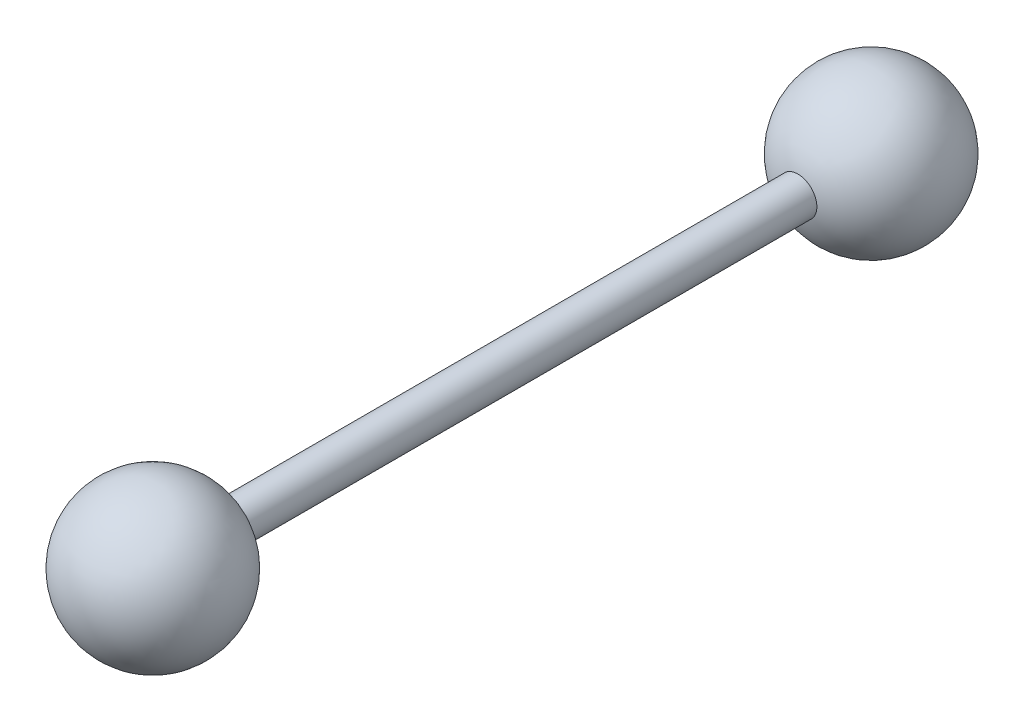
from build123d import *

# Parameters (mm, degrees)
SKETCH5_R                = 5
SKETCH5_R_2              = 3.5
BOSS_EXTRUDE2_DEPTH      = 4
BOSS_EXTRUDE3_DEPTH      = 154
BOSS_EXTRUDE3_DEPTH_BACK = 4
SKETCH5_2_R              = 5
SKETCH5_2_R_2            = 3.5


with BuildPart() as part:
    # Sketch4 → Revolve1 (revolve)
    with BuildSketch(Plane.XY):
        with BuildLine():
            Line((-3.046357616, 14.635761589), (-3.046357616, 10.635761589))
            ThreePointArc((-3.046357616, 10.635761589), (12.953642384, -5.364238411), (-3.046357616, -21.364238411))
            Line((-3.046357616, -21.364238411), (-3.046357616, -25.364238411))
            ThreePointArc((-3.046357616, -25.364238411), (16.953642384, -5.364238411), (-3.046357616, 14.635761589))
        make_face()
    revolve(axis=Axis((-3.046357616, 14.635761589, 0), (0, -1, 0)))

    # Sketch5 → Boss-Extrude2 (add)
    with BuildSketch(Plane.XY.offset(20)):
        with Locations((-3.046357616, -5.364238411)):
            Circle(SKETCH5_R)
        with Locations((-3.046357616, -5.364238411)):
            Circle(SKETCH5_R_2, mode=Mode.SUBTRACT)
    extrude(amount=-BOSS_EXTRUDE2_DEPTH)

    # Sketch5<2> → Boss-Extrude3 (add, two sides: drawn at the far end of the back side and taken through both)
    with BuildSketch(Plane.XY.offset(20).offset(-BOSS_EXTRUDE3_DEPTH_BACK)):
        with Locations((-3.046357616, -5.364238411)):
            Circle(SKETCH5_2_R)
        with Locations((-3.046357616, -5.364238411)):
            Circle(SKETCH5_2_R_2, mode=Mode.SUBTRACT)
    extrude(amount=BOSS_EXTRUDE3_DEPTH + BOSS_EXTRUDE3_DEPTH_BACK)


with BuildPart() as body_2:
    # Sketch7 → Revolve3 (revolve)
    with BuildSketch(Plane.XY.offset(190)):
        with BuildLine():
            Line((-3.046357616, 14.635761589), (-3.046357616, 10.635761589))
            ThreePointArc((-3.046357616, 10.635761589), (12.953642384, -5.364238411), (-3.046357616, -21.364238411))
            Line((-3.046357616, -21.364238411), (-3.046357616, -25.364238411))
            ThreePointArc((-3.046357616, -25.364238411), (16.953642384, -5.364238411), (-3.046357616, 14.635761589))
        make_face()
    revolve(axis=Axis((-3.046357616, 14.635761589, 190), (0, -1, 0)))


solid = Compound([part.part, body_2.part])
